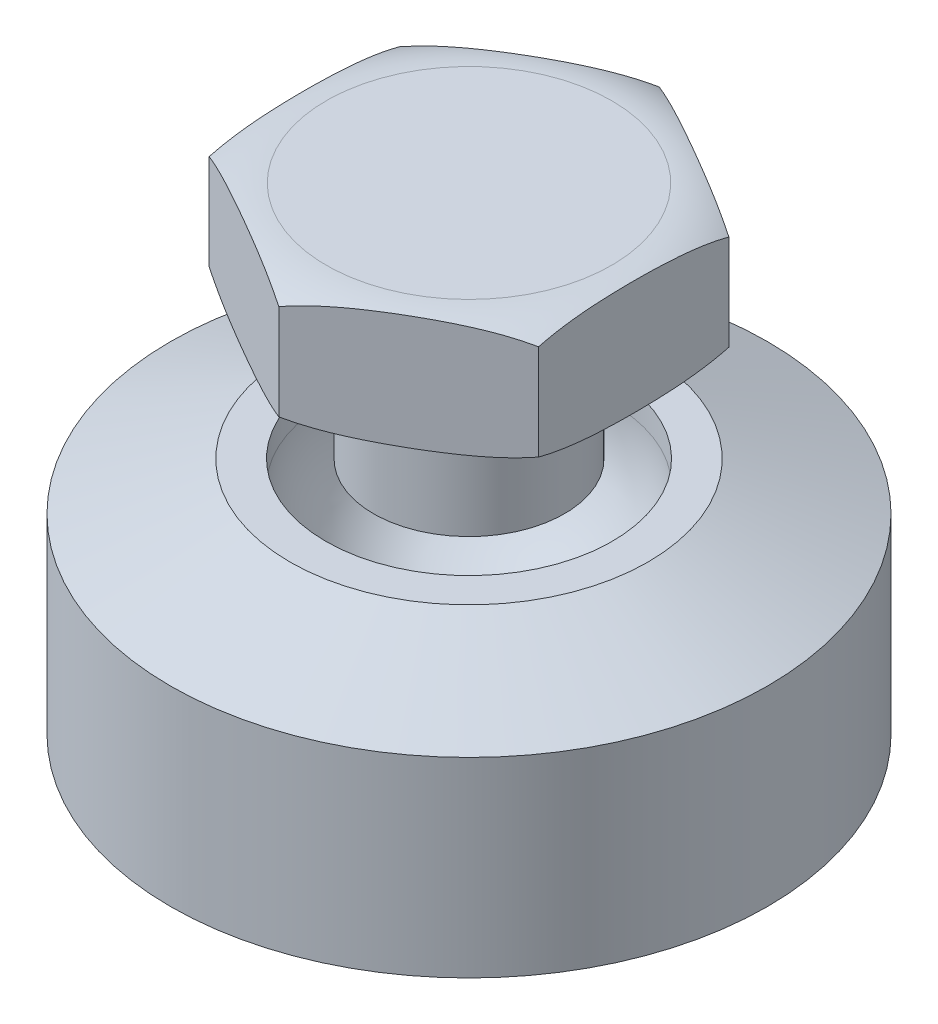
from build123d import *

# Parameters (mm, degrees)
SKETCH7_W      = 4
SKETCH7_H      = 5
EXTRUDE3_DEPTH = 5


with BuildPart() as part:
    # Sketch1 → Revolve1 (revolve)
    with BuildSketch(Plane.XY, mode=Mode.PRIVATE) as revolve1_sk:
        with BuildLine():
            Line((12.5, 0), (12.5, 8))
            Line((12.5, 8), (7.5, 10))
            Line((7.5, 10), (6, 10))
            Line((6, 10), (6, 9))
            ThreePointArc((6, 9), (4.208099244, 4.937980798), (0, 3.522774425))
            Line((0, 3.522774425), (0, 2.5))
            Line((0, 2.5), (3.75, 2.5))
            Line((3.75, 2.5), (3.75, 0))
            Line((3.75, 0), (12.5, 0))
        make_face()
    revolve(revolve1_sk.sketch.rotate(Axis((0, 280.708212389, 0), (0, -1, 0)), 90), axis=Axis((0, 280.708212389, 0), (0, -1, 0)))


with BuildPart() as body_2:
    # Sketch7 → Revolve2 (revolve)
    with BuildSketch(Plane.XY, mode=Mode.PRIVATE) as revolve2_sk:
        with Locations((2, 12.5)):
            Rectangle(SKETCH7_W, SKETCH7_H)
    revolve(revolve2_sk.sketch.rotate(Axis((0, 15, 0), (0, -1, 0)), 180), axis=Axis((0, 15, 0), (0, -1, 0)))

    # Sketch8 → Extrude3 (add)
    with BuildSketch(Plane(origin=(0, 15, 0), x_dir=(1, 0, 0), z_dir=(0, 1, 0))):
        Polygon((0, 7.967433715), (-6.9, 3.983716857), (-6.9, -3.983716857), (0, -7.967433715), (6.9, -3.983716857), (6.9, 3.983716857), align=None)
    extrude(amount=EXTRUDE3_DEPTH)

    # Sketch10 → Cut-Revolve1 (revolve, cut)
    with BuildSketch(Plane(origin=(0, 0, 0), x_dir=(0, 0, -1), z_dir=(1, 0, 0)), mode=Mode.PRIVATE) as cut_revolve1_sk:
        with BuildLine():
            Line((-7.967433715, 20), (-7.967433715, 19.5))
            ThreePointArc((-7.967433715, 19.5), (-7.002402925, 19.873090575), (-5.975575286, 20))
            Line((-5.975575286, 20), (-7.967433715, 20))
        make_face()
        with BuildLine():
            Line((-7.967433715, 15), (-5.975575286, 15))
            ThreePointArc((-5.975575286, 15), (-7.002402925, 15.126909425), (-7.967433715, 15.5))
            Line((-7.967433715, 15.5), (-7.967433715, 15))
        make_face()
    revolve(cut_revolve1_sk.sketch.rotate(Axis((0, 20, 0), (0, 1, 0)), 180), axis=Axis((0, 20, 0), (0, 1, 0)), mode=Mode.SUBTRACT)


solid = Compound([part.part, body_2.part])
